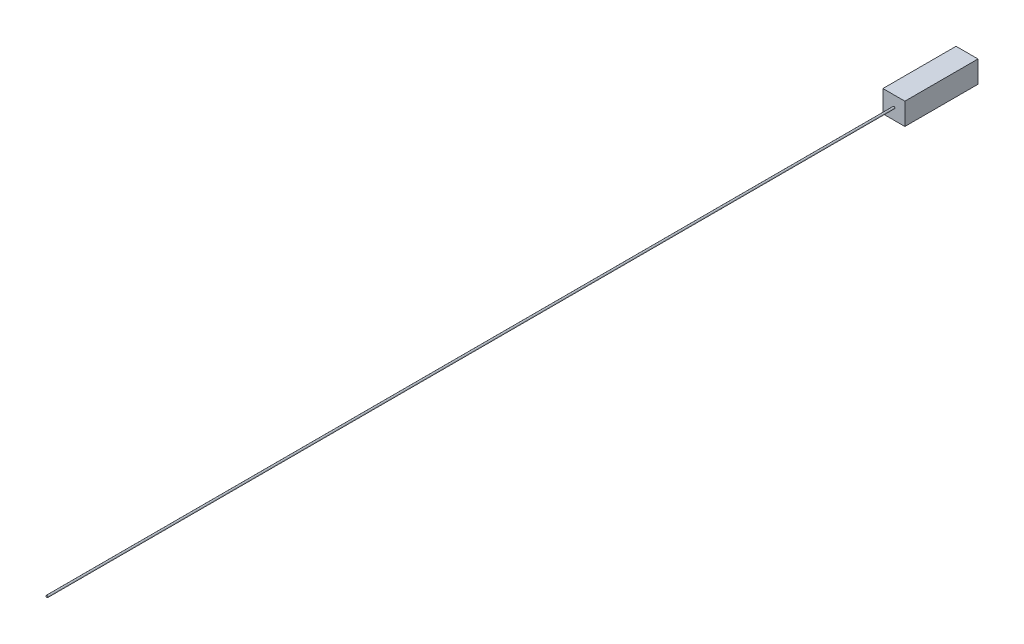
from build123d import *

# Parameters (mm, degrees)
ESBO_O1_W                = 5.7
ESBO_O1_H                = 5.7
RESSALTO_EXTRUS_O1_DEPTH = 19
ESBO_O2_R                = 0.25
RESSALTO_EXTRUS_O2_DEPTH = 220


with BuildPart() as part:
    # Esboço1 → Ressalto-extrusão1 (new body)
    with BuildSketch(Plane.XY):
        Rectangle(ESBO_O1_W, ESBO_O1_H)
    extrude(amount=RESSALTO_EXTRUS_O1_DEPTH)

    # Esboço2 → Ressalto-extrusão2 (add)
    with BuildSketch(Plane.XY.offset(19)):
        with Locations(Location((0, 0, 0), (0, 0, 180))):
            Circle(ESBO_O2_R)
    extrude(amount=RESSALTO_EXTRUS_O2_DEPTH)


solid = part.part
